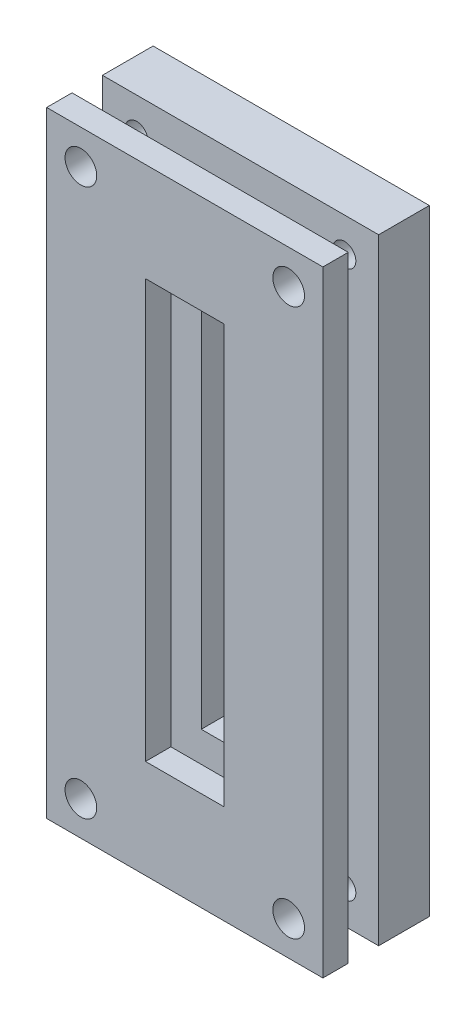
from build123d import *

# Parameters (mm, degrees)
SKETCH1_W           = 6.2
SKETCH1_H           = 33
BOSS_EXTRUDE1_DEPTH = 4.5
SHELL1_T            = 2.4
SKETCH2_W           = 21.8
SKETCH2_H           = 48.6
SKETCH2_R           = 0.9
SKETCH2_W_2         = 11
SKETCH2_H_2         = 37.8
BOSS_EXTRUDE2_DEPTH = 4
BOSS_EXTRUDE3_START = 2.4
SKETCH3_W           = 21.8
SKETCH3_H           = 48.6
SKETCH3_R           = 1.25
SKETCH3_W_2         = 6.2
SKETCH3_H_2         = 33
BOSS_EXTRUDE3_DEPTH = 2


with BuildPart() as part:
    # Sketch1 → Boss-Extrude1 (new body)
    with BuildSketch(Plane.XY):
        Rectangle(SKETCH1_W, SKETCH1_H)
    extrude(amount=BOSS_EXTRUDE1_DEPTH)

    # Shell1
    shell1_openings = [part.faces().sort_by_distance(p)[0] for p in [
        (0, 0, 0),
        (0, 0, 4.5),
    ]]
    offset(amount=SHELL1_T, openings=shell1_openings, kind=Kind.INTERSECTION)

    # Sketch2 → Boss-Extrude2 (add)
    with BuildSketch(Plane.XY.offset(4.5)):
        Rectangle(SKETCH2_W, SKETCH2_H)
        with Locations((-8.2, 21.6)):
            Circle(SKETCH2_R, mode=Mode.SUBTRACT)
        with Locations((8.2, 21.6)):
            Circle(SKETCH2_R, mode=Mode.SUBTRACT)
        with Locations(Location((8.2, -21.6, 0), (0, 0, 180))):
            Circle(SKETCH2_R, mode=Mode.SUBTRACT)
        with Locations(Location((-8.2, -21.6, 0), (0, 0, 180))):
            Circle(SKETCH2_R, mode=Mode.SUBTRACT)
        Rectangle(SKETCH2_W_2, SKETCH2_H_2, mode=Mode.SUBTRACT)
    extrude(amount=-BOSS_EXTRUDE2_DEPTH)


with BuildPart() as body_2:
    # Sketch3 → Boss-Extrude3 (new body)
    with BuildSketch(Plane.XY.offset(4.5).offset(BOSS_EXTRUDE3_START)):
        Rectangle(SKETCH3_W, SKETCH3_H)
        with Locations((-8.2, 21.6)):
            Circle(SKETCH3_R, mode=Mode.SUBTRACT)
        with Locations((8.2, 21.6)):
            Circle(SKETCH3_R, mode=Mode.SUBTRACT)
        with Locations((-8.2, -21.6)):
            Circle(SKETCH3_R, mode=Mode.SUBTRACT)
        with Locations((8.2, -21.6)):
            Circle(SKETCH3_R, mode=Mode.SUBTRACT)
        Rectangle(SKETCH3_W_2, SKETCH3_H_2, mode=Mode.SUBTRACT)
    extrude(amount=BOSS_EXTRUDE3_DEPTH)


solid = Compound([part.part, body_2.part])
